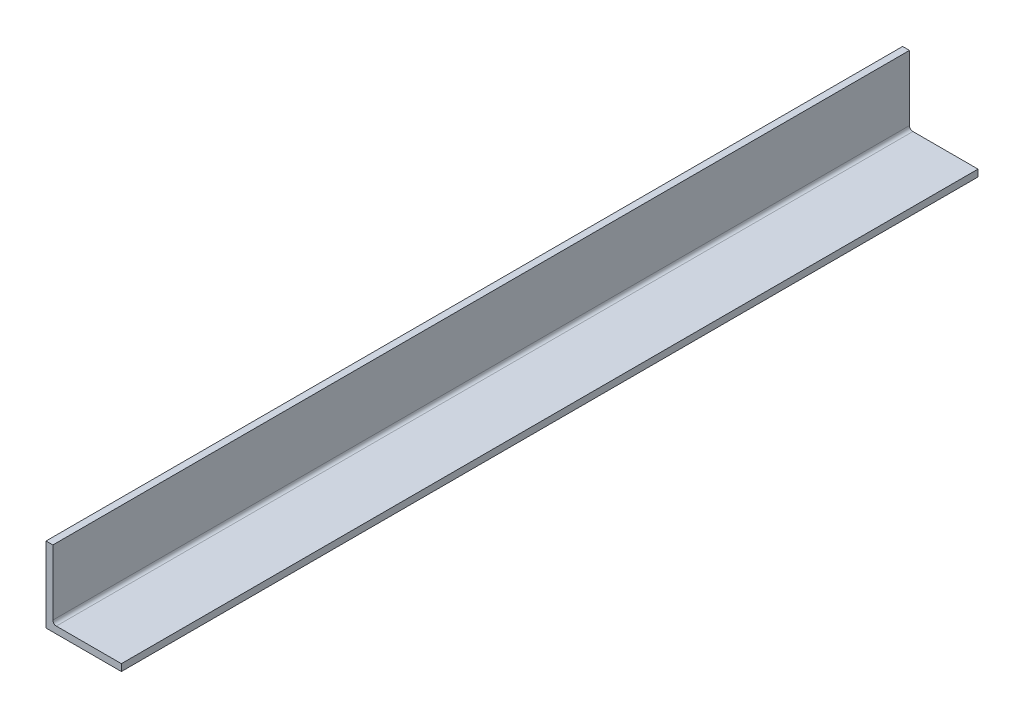
from build123d import *

# Parameters (mm, degrees)
SALIENTE_EXTRUIR1_DEPTH = 250


with BuildPart() as part:
    # Croquis1 → Saliente-Extruir1 (new, symmetric)
    with BuildSketch(Plane.XY):
        with BuildLine():
            Line((0, 2), (0, 40))
            Line((0, 40), (-4, 40))
            Line((-4, 40), (-4, -4))
            Line((-4, -4), (40, -4))
            Line((40, -4), (40, 0))
            Line((40, 0), (2, 0))
            ThreePointArc((2, 0), (0.585786438, 0.585786438), (0, 2))
        make_face()
    extrude(amount=SALIENTE_EXTRUIR1_DEPTH, both=True)


solid = part.part
